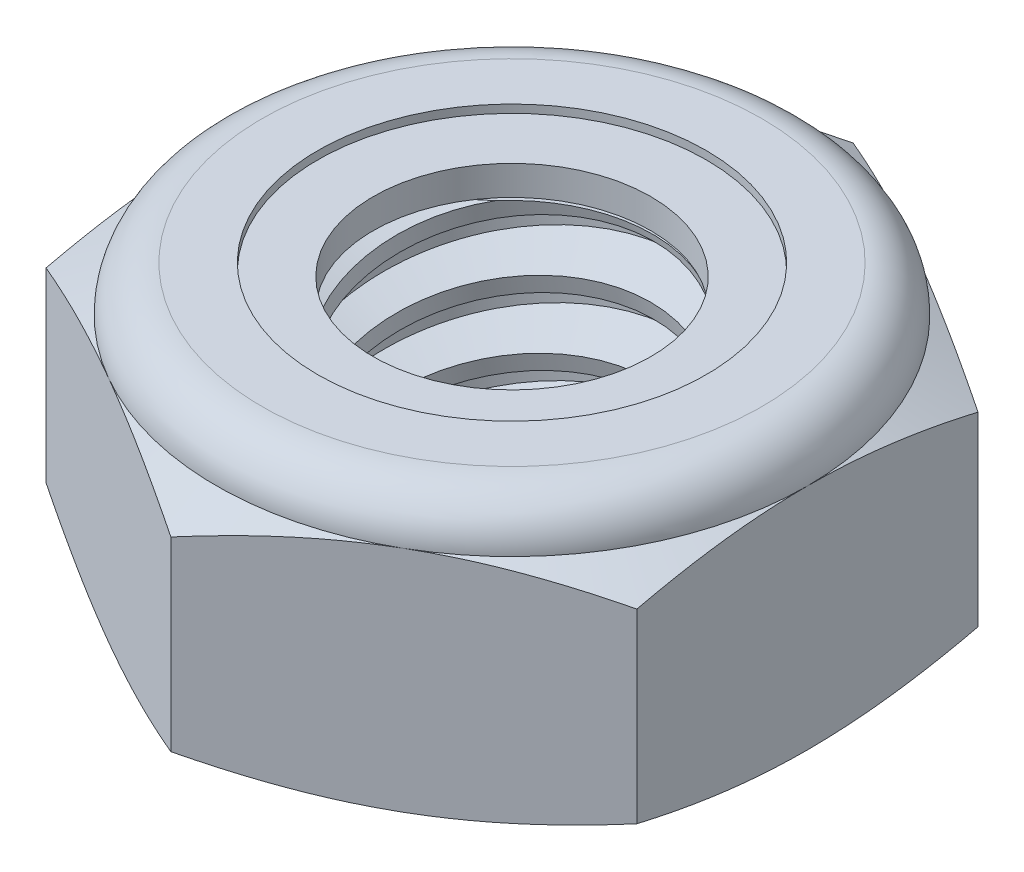
from build123d import *

# Parameters (mm, degrees)
EXTRUDE1_DEPTH      = 5.159375
SKETCH2_W           = 3.175
SKETCH2_H           = 5.159375
LPATTERN1_COUNT     = 4
LPATTERN1_PITCH     = 1.27
LPATTERN1_COL_COUNT = 2
LPATTERN1_COL_PITCH = 1.27


with BuildPart() as part:
    # Sketch1 → Extrude1 (new body)
    with BuildSketch(Plane(origin=(0, 0, 0), x_dir=(1, 0, 0), z_dir=(0, 1, 0))):
        Polygon((0, 6.415804866), (-5.55625, 3.207902433), (-5.55625, -3.207902433), (0, -6.415804866), (5.55625, -3.207902433), (5.55625, 3.207902433), align=None)
    extrude(amount=EXTRUDE1_DEPTH)

    # Sketch4 → Cut-Revolve2 (revolve, cut)
    with BuildSketch(Plane(origin=(0, 0, 0), x_dir=(0, 0, -1), z_dir=(1, 0, 0)), mode=Mode.PRIVATE) as cut_revolve2_sk:
        Polygon((0, 5.159375), (3.175, 5.159375), (2.609908356, 4.895868439), (2.609908356, 0.263506561), (3.175, 0), (0, 0), align=None)
    revolve(cut_revolve2_sk.sketch.rotate(Axis((0, 5.159375, 0), (0, 1, 0)), 34.505533911), axis=Axis((0, 5.159375, 0), (0, 1, 0)), mode=Mode.SUBTRACT)


with BuildPart() as body_2:
    # Sketch2 → Revolve1 (revolve)
    with BuildSketch(Plane(origin=(0, 0, 0), x_dir=(0, 0, -1), z_dir=(1, 0, 0))):
        with Locations((1.5875, 2.5796875)):
            Rectangle(SKETCH2_W, SKETCH2_H)
    revolve(axis=Axis((0, -3.175, 0), (0, 1, 0)))

    # Sketch3 → Cut-Revolve1 (revolve, cut)
    with BuildSketch(Plane(origin=(0, 0, 0), x_dir=(0, 0, -1), z_dir=(1, 0, 0)), mode=Mode.PRIVATE) as cut_revolve1_sk:
        Polygon((3.206133436, 5.003707818), (3.424067492, 3.914037542), (2.672175229, 4.168393763), (2.609908356, 4.479728128), align=None)
    cut_revolve1 = revolve(cut_revolve1_sk.sketch.rotate(Axis((0, 5.159375, 0.272704483), (0, -0.9805806756909201, -0.19611613513818413)), 180), axis=Axis((0, 5.159375, 0.272704483), (0, -0.9805806756909201, -0.19611613513818413)), mode=Mode.SUBTRACT)

    # LPattern1: Cut-Revolve1 ×4
    with Locations(*[(0, -i * LPATTERN1_PITCH, 0) for i in range(1, LPATTERN1_COUNT)]):
        add(cut_revolve1, mode=Mode.SUBTRACT)

    # LPattern1 col: Cut-Revolve1 ×2
    with Locations(*[(0, i * LPATTERN1_COL_PITCH, 0) for i in range(1, LPATTERN1_COL_COUNT)]):
        add(cut_revolve1, mode=Mode.SUBTRACT)


with BuildPart() as part_1:
    add(part.part)

    # Combine1: cut body 2
    add(body_2.part, mode=Mode.SUBTRACT)

    # Sketch5 → Cut-Revolve3 (revolve, cut)
    with BuildSketch(Plane(origin=(0, 0, 0), x_dir=(0, 0, -1), z_dir=(1, 0, 0)), mode=Mode.PRIVATE) as cut_revolve3_sk:
        with BuildLine():
            Line((0, 0), (5.55625, 0))
            Line((5.55625, 0), (6.415804866, 0.400817017))
            Line((6.415804866, 0.400817017), (6.415804866, 3.89866215))
            Line((6.415804866, 3.89866215), (5.55625, 4.299479167))
            ThreePointArc((5.55625, 4.299479167), (5.304392342, 4.907517342), (4.696354167, 5.159375))
            Line((4.696354167, 5.159375), (4.696354167, 6.429375))
            Line((4.696354167, 6.429375), (7.685804866, 6.429375))
            Line((7.685804866, 6.429375), (7.685804866, -1.27))
            Line((7.685804866, -1.27), (0, -1.27))
            Line((0, -1.27), (0, 0))
        make_face()
    revolve(cut_revolve3_sk.sketch.rotate(Axis((0, 0, 0), (0, 1, 0)), 54.619043446), axis=Axis((0, 0, 0), (0, 1, 0)), mode=Mode.SUBTRACT)

    # Sketch6 → Cut-Revolve4 (revolve, cut)
    with BuildSketch(Plane(origin=(0, 0, 0), x_dir=(0, 0, -1), z_dir=(1, 0, 0)), mode=Mode.PRIVATE) as cut_revolve4_sk:
        with BuildLine():
            Line((0, 4.299479167), (5.40385, 4.299479167))
            ThreePointArc((5.40385, 4.299479167), (5.196629268, 4.799754268), (4.696354167, 5.006975))
            Line((4.696354167, 5.006975), (3.653131261, 5.006975))
            Line((3.653131261, 5.006975), (3.653131261, 6.429375))
            Line((3.653131261, 6.429375), (0, 6.429375))
            Line((0, 6.429375), (0, 4.299479167))
        make_face()
    revolve(cut_revolve4_sk.sketch.rotate(Axis((0, 6.429375, 0), (0, 1, 0)), 54.619043446), axis=Axis((0, 6.429375, 0), (0, 1, 0)), mode=Mode.SUBTRACT)


with BuildPart() as body_2_2:
    # Sketch7 → Revolve2 (revolve)
    with BuildSketch(Plane(origin=(0, 0, 0), x_dir=(0, 0, -1), z_dir=(1, 0, 0))):
        with BuildLine():
            Line((2.609908356, 4.375679167), (5.3230343, 4.375679167))
            ThreePointArc((5.3230343, 4.375679167), (5.114940888, 4.772046184), (4.696354167, 4.930775))
            Line((4.696354167, 4.930775), (2.609908356, 4.930775))
            Line((2.609908356, 4.930775), (2.609908356, 4.375679167))
        make_face()
    revolve(axis=Axis((0, 4.375679167, 0), (0, 1, 0)))


solid = Compound([part_1.part, body_2_2.part])
